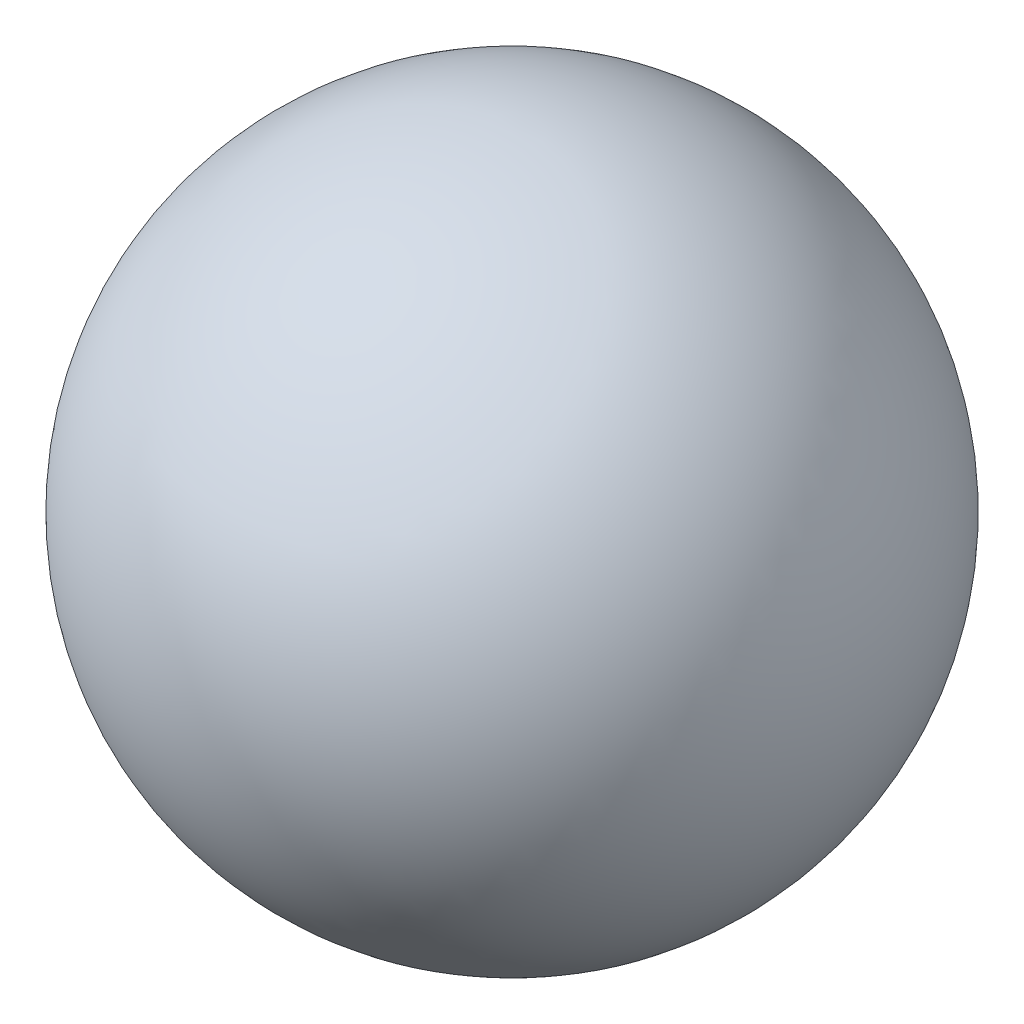
from build123d import *


with BuildPart() as part:
    # Sketch1 → Revolve1 (revolve)
    with BuildSketch(Plane.XY):
        with BuildLine():
            Line((0, 3.571875), (0, -3.571875))
            ThreePointArc((0, -3.571875), (-3.571875, 0), (0, 3.571875))
        make_face()
    revolve(axis=Axis((0, 3.9290625, 0), (0, -1, 0)))


solid = part.part
